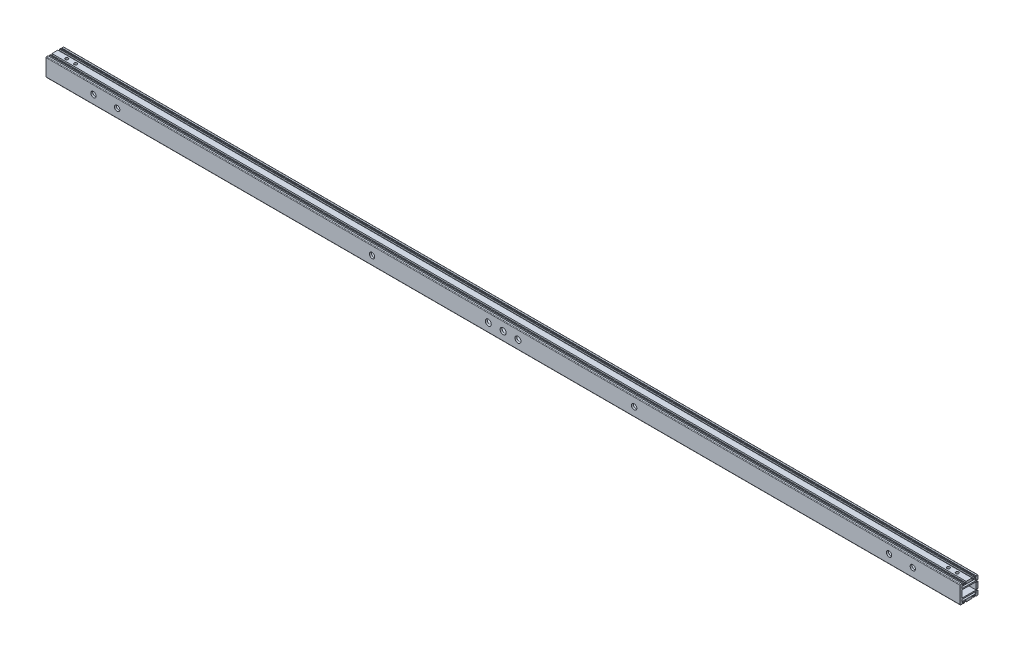
from build123d import *

# Parameters (mm, degrees)
SKETCH_1_W             = 23.5
SKETCH_1_H             = 12
EXTRUDE_1_DEPTH        = 771
HOLE_WIZARD_M6_3_D     = 5
HOLE_WIZARD_M6_3_DEPTH = 15
HOLE_WIZARD_M6_3_TIP   = 1.502151548
SKETCH_13_R            = 5.05
CUT_EXTRUDE_6_DEPTH    = 772.729227126
HOLE_WIZARD_M6_4_D     = 5
HOLE_WIZARD_M6_4_DEPTH = 15
HOLE_WIZARD_M6_4_TIP   = 1.502151548
SKETCH_10_R            = 4.5
CUT_EXTRUDE_7_DEPTH    = 772.729227126
HOLE_WIZARD_M6_5_D     = 5
HOLE_WIZARD_M6_5_DEPTH = 15
HOLE_WIZARD_M6_5_TIP   = 1.502151548


with BuildPart() as part:
    # 草图1 → 凸台-拉伸1 (new, symmetric)
    with BuildSketch(Plane(origin=(0, 0, 0), x_dir=(0, 0, -1), z_dir=(1, 0, 0))):
        with BuildLine():
            Line((-14, 15), (-11.5, 15))
            Line((-11.5, 15), (-11.5, 13.5))
            Line((-11.5, 13.5), (-11.4, 13.5))
            ThreePointArc((-11.4, 13.5), (-11.117157288, 13.382842712), (-11, 13.1))
            Line((-11, 13.1), (-11, 12))
            Line((-11, 12), (-9.5, 12))
            Line((-9.5, 12), (-9.5, 15))
            Line((-9.5, 15), (-8, 15))
            Line((-8, 15), (-8, 12.5))
            Line((-8, 12.5), (-5, 12.5))
            Line((-5, 12.5), (-5, 15))
            Line((-5, 15), (5, 15))
            Line((5, 15), (5, 12.5))
            Line((5, 12.5), (8, 12.5))
            Line((8, 12.5), (8, 15))
            Line((8, 15), (9.5, 15))
            Line((9.5, 15), (9.5, 12))
            Line((9.5, 12), (11, 12))
            Line((11, 12), (11, 13.1))
            ThreePointArc((11, 13.1), (11.117157288, 13.382842712), (11.4, 13.5))
            Line((11.4, 13.5), (11.5, 13.5))
            Line((11.5, 13.5), (11.5, 15))
            Line((11.5, 15), (14, 15))
            ThreePointArc((14, 15), (14.707106781, 14.707106781), (15, 14))
            Line((15, 14), (15, 8))
            Line((15, 8), (12.5, 8))
            Line((12.5, 8), (12.5, 5))
            Line((12.5, 5), (15, 5))
            Line((15, 5), (15, -5))
            Line((15, -5), (12.5, -5))
            Line((12.5, -5), (12.5, -8))
            Line((12.5, -8), (15, -8))
            Line((15, -8), (15, -14))
            ThreePointArc((15, -14), (14.707106781, -14.707106781), (14, -15))
            Line((14, -15), (11.5, -15))
            Line((11.5, -15), (11.5, -13.5))
            Line((11.5, -13.5), (11.4, -13.5))
            ThreePointArc((11.4, -13.5), (11.117157288, -13.382842712), (11, -13.1))
            Line((11, -13.1), (11, -12))
            Line((11, -12), (9.5, -12))
            Line((9.5, -12), (9.5, -15))
            Line((9.5, -15), (8, -15))
            Line((8, -15), (8, -12.5))
            Line((8, -12.5), (5, -12.5))
            Line((5, -12.5), (5, -15))
            Line((5, -15), (-5, -15))
            Line((-5, -15), (-5, -12.5))
            Line((-5, -12.5), (-8, -12.5))
            Line((-8, -12.5), (-8, -15))
            Line((-8, -15), (-9.5, -15))
            Line((-9.5, -15), (-9.5, -12))
            Line((-9.5, -12), (-11, -12))
            Line((-11, -12), (-11, -13.1))
            ThreePointArc((-11, -13.1), (-11.117157288, -13.382842712), (-11.4, -13.5))
            Line((-11.4, -13.5), (-11.5, -13.5))
            Line((-11.5, -13.5), (-11.5, -15))
            Line((-11.5, -15), (-14, -15))
            ThreePointArc((-14, -15), (-14.707106781, -14.707106781), (-15, -14))
            Line((-15, -14), (-15, 14))
            ThreePointArc((-15, 14), (-14.707106781, 14.707106781), (-14, 15))
        make_face()
        with BuildLine():
            Line((12, -10.5), (12, -8.5))
            ThreePointArc((12, -8.5), (11.853553391, -8.146446609), (11.5, -8))
            Line((11.5, -8), (-11.5, -8))
            ThreePointArc((-11.5, -8), (-11.853553391, -8.146446609), (-12, -8.5))
            Line((-12, -8.5), (-12, -10.5))
            ThreePointArc((-12, -10.5), (-11.853553391, -10.853553391), (-11.5, -11))
            Line((-11.5, -11), (11.5, -11))
            ThreePointArc((11.5, -11), (11.853553391, -10.853553391), (12, -10.5))
        make_face(mode=Mode.SUBTRACT)
        with BuildLine():
            Line((-11.5, 11), (11.5, 11))
            ThreePointArc((11.5, 11), (11.853553391, 10.853553391), (12, 10.5))
            Line((12, 10.5), (12, 8.5))
            ThreePointArc((12, 8.5), (11.853553391, 8.146446609), (11.5, 8))
            Line((11.5, 8), (-11.5, 8))
            ThreePointArc((-11.5, 8), (-11.853553391, 8.146446609), (-12, 8.5))
            Line((-12, 8.5), (-12, 10.5))
            ThreePointArc((-12, 10.5), (-11.853553391, 10.853553391), (-11.5, 11))
        make_face(mode=Mode.SUBTRACT)
        Rectangle(SKETCH_1_W, SKETCH_1_H, mode=Mode.SUBTRACT)
    extrude(amount=EXTRUDE_1_DEPTH, both=True)

    # M6 螺纹孔3
    with Locations(Plane(origin=(0, 0, -15), x_dir=(-1, 0, 0), z_dir=(0, 0, -1))):
        with Locations((-751, 0), (-736, 0), (736, 0), (751, 0)):
            Hole(HOLE_WIZARD_M6_3_D / 2, depth=HOLE_WIZARD_M6_3_DEPTH)
            with Locations((0, 0, -(HOLE_WIZARD_M6_3_DEPTH + HOLE_WIZARD_M6_3_TIP / 2))):  # 118° drill point
                Cone(0, HOLE_WIZARD_M6_3_D / 2, HOLE_WIZARD_M6_3_TIP, mode=Mode.SUBTRACT)

    # 草图13 → 切除-拉伸6 (cut, through all)
    with BuildSketch(Plane(origin=(0, 0, -15), x_dir=(-1, 0, 0), z_dir=(0, 0, -1))):
        Circle(SKETCH_13_R)
        with Locations((25, 0)):
            Circle(SKETCH_13_R)
        with Locations((-25, 0)):
            Circle(SKETCH_13_R)
    extrude(amount=-CUT_EXTRUDE_6_DEPTH, mode=Mode.SUBTRACT)

    # M6 螺纹孔4
    with Locations(Plane(origin=(0, 0, -15), x_dir=(-1, 0, 0), z_dir=(0, 0, -1))):
        with Locations((-411, 0), (-351, 0), (351, 0), (411, 0)):
            Hole(HOLE_WIZARD_M6_4_D / 2, depth=HOLE_WIZARD_M6_4_DEPTH)
            with Locations((0, 0, -(HOLE_WIZARD_M6_4_DEPTH + HOLE_WIZARD_M6_4_TIP / 2))):  # 118° drill point
                Cone(0, HOLE_WIZARD_M6_4_D / 2, HOLE_WIZARD_M6_4_TIP, mode=Mode.SUBTRACT)

    # 草图10 → 切除-拉伸7 (cut, through all)
    with BuildSketch(Plane(origin=(0, 0, -15), x_dir=(-1, 0, 0), z_dir=(0, 0, -1))):
        with Locations((-651, 0)):
            Circle(SKETCH_10_R)
        with Locations((-221, 0)):
            Circle(SKETCH_10_R)
        with Locations((221, 0)):
            Circle(SKETCH_10_R)
        with Locations((651, 0)):
            Circle(SKETCH_10_R)
        with Locations((691, 0)):
            Circle(SKETCH_10_R)
        with Locations((-691, 0)):
            Circle(SKETCH_10_R)
    extrude(amount=-CUT_EXTRUDE_7_DEPTH, mode=Mode.SUBTRACT)

    # M6 螺纹孔5
    with Locations(Plane(origin=(0, 15, 0), x_dir=(-1, 0, 0), z_dir=(0, 1, 0))):
        with Locations((-751, 0), (-736, 0), (736, 0), (751, 0)):
            Hole(HOLE_WIZARD_M6_5_D / 2, depth=HOLE_WIZARD_M6_5_DEPTH)
            with Locations((0, 0, -(HOLE_WIZARD_M6_5_DEPTH + HOLE_WIZARD_M6_5_TIP / 2))):  # 118° drill point
                Cone(0, HOLE_WIZARD_M6_5_D / 2, HOLE_WIZARD_M6_5_TIP, mode=Mode.SUBTRACT)


solid = part.part
